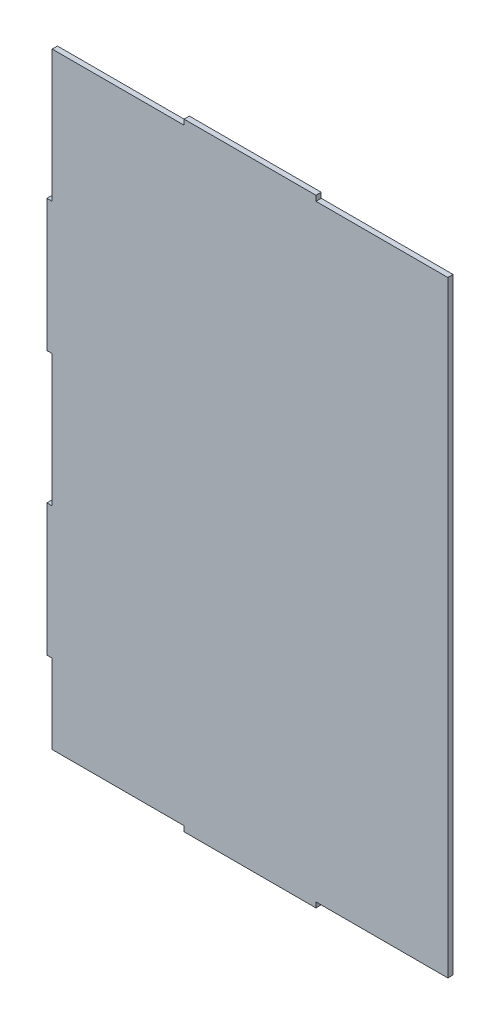
from build123d import *

# Parameters (mm, degrees)
EXTRUDE_1_DEPTH = 4


with BuildPart() as part:
    # 草图2 → 凸台-拉伸1 (new body)
    with BuildSketch(Plane.XY):
        Polygon((-152, -170), (-148, -170), (-148, -230), (-48, -230), (-48, -234), (52, -234), (52, -230), (152, -230), (152, -170), (152, 130), (152, 230), (52, 230), (52, 234), (-48, 234), (-48, 230), (-148, 230), (-148, 130), (-152, 130), (-152, 30), (-148, 30), (-148, -70), (-152, -70), align=None)
    extrude(amount=EXTRUDE_1_DEPTH)


solid = part.part
